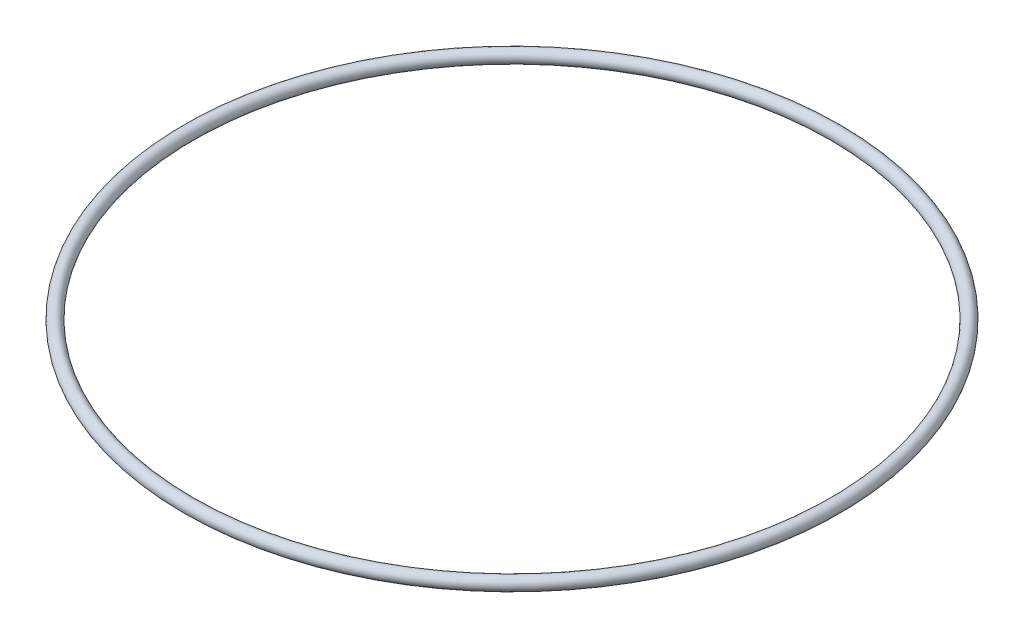
from build123d import *

# Parameters (mm, degrees)
SKETCH1_R = 0.8255


with BuildPart() as part:
    # Sketch1 → Revolve1 (revolve)
    with BuildSketch(Plane.XY, mode=Mode.PRIVATE) as revolve1_sk:
        with Locations((-41.91, 0)):
            Circle(SKETCH1_R)
    revolve(revolve1_sk.sketch.rotate(Axis((0, 0, 0), (0, 1, 0)), 270), axis=Axis((0, 0, 0), (0, 1, 0)))


solid = part.part
